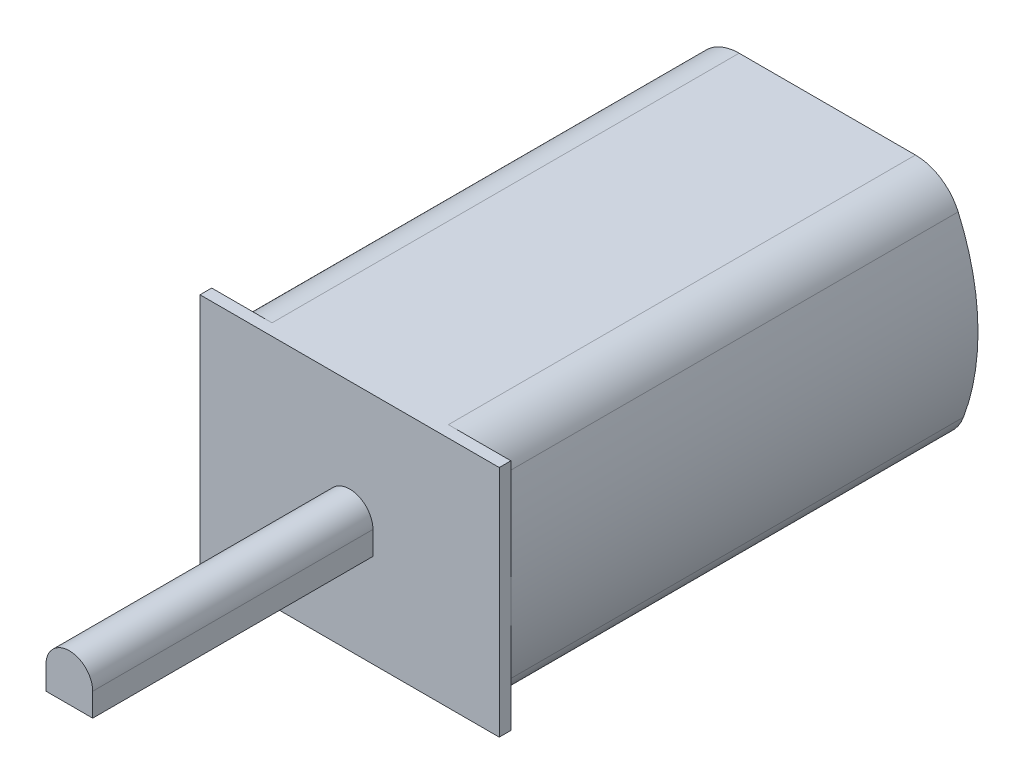
from build123d import *

# Parameters (mm, degrees)
BOSS_EXTRUDE1_DEPTH = 20
BOSS_EXTRUDE2_DEPTH = 0.5
BOSS_EXTRUDE3_DEPTH = 12


with BuildPart() as part:
    # Sketch1 → Boss-Extrude1 (new body)
    with BuildSketch(Plane.XY):
        with BuildLine():
            Line((1.244055551, 0), (8.976470711, 0))
            ThreePointArc((8.976470711, 0), (10.119336086, 0.358702119), (10.85225323, 1.306141266))
            ThreePointArc((10.85225323, 1.306141266), (11.468754399, 5.078261149), (10.62502936, 8.806141266))
            ThreePointArc((10.62502936, 8.806141266), (9.887330043, 9.675154102), (8.794691615, 10))
            Line((8.794691615, 10), (1.244055551, 10))
            ThreePointArc((1.244055551, 10), (0.126021562, 9.658312395), (-0.609994071, 8.75))
            ThreePointArc((-0.609994071, 8.75), (-1.339745962, 5), (-0.609994071, 1.25))
            ThreePointArc((-0.609994071, 1.25), (0.126021562, 0.341687605), (1.244055551, 0))
        make_face()
    extrude(amount=BOSS_EXTRUDE1_DEPTH)

    # Sketch3 → Boss-Extrude2 (add)
    with BuildSketch(Plane.XY.offset(20)):
        Polygon((-1.339745962, 5), (-1.339745962, 0), (11.473340637, 0), (11.473340637, 4.775434937), (11.473340637, 10), (-1.339745962, 10), align=None)
    extrude(amount=BOSS_EXTRUDE2_DEPTH)

    # Sketch4 → Boss-Extrude3 (add)
    with BuildSketch(Plane.XY.offset(20.5)):
        with BuildLine():
            Line((4.065254038, 4), (6.065254038, 4))
            Line((6.065254038, 4), (6.065254038, 5))
            ThreePointArc((6.065254038, 5), (5.065254038, 6), (4.065254038, 5))
            Line((4.065254038, 5), (4.065254038, 4))
        make_face()
    extrude(amount=BOSS_EXTRUDE3_DEPTH)


solid = part.part
